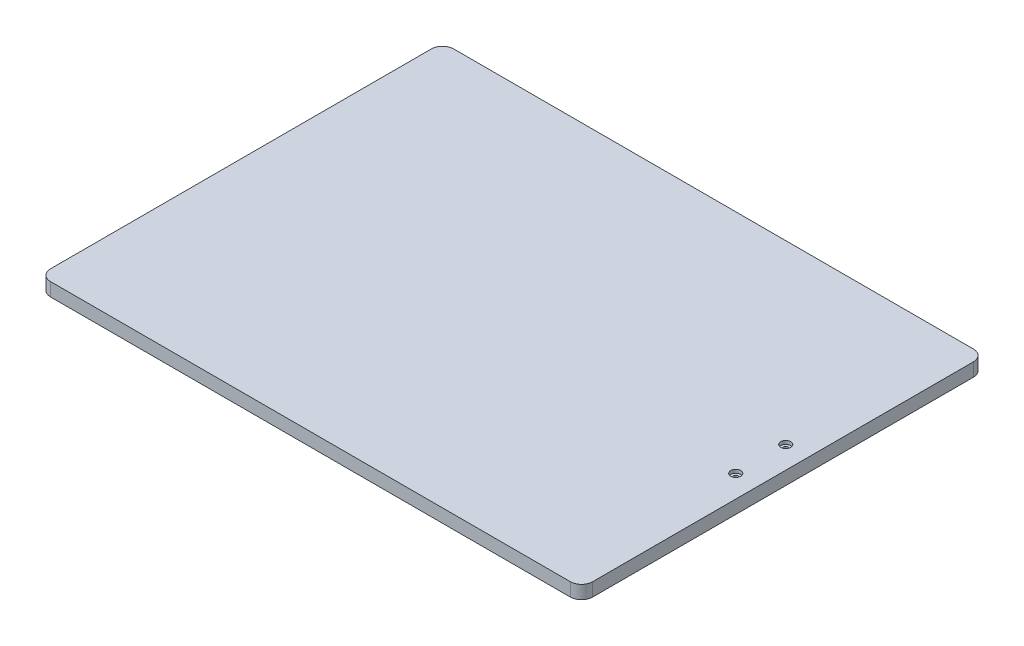
from build123d import *

# Parameters (mm, degrees)
SKETCH1_W                                        = 487.5
SKETCH1_H                                        = 362.5
BOSS_EXTRUDE1_DEPTH                              = 12
FILLET1_R                                        = 10
CBORE_FOR_M4_PAN_HEAD_MACHINE_SCREW1_D           = 4.5
CBORE_FOR_M4_PAN_HEAD_MACHINE_SCREW1_CBORE_D     = 9
CBORE_FOR_M4_PAN_HEAD_MACHINE_SCREW1_CBORE_DEPTH = 3.1


with BuildPart() as part:
    # Sketch1 → Boss-Extrude1 (new body)
    with BuildSketch(Plane(origin=(0, 0, 0), x_dir=(1, 0, 0), z_dir=(0, 1, 0))):
        Rectangle(SKETCH1_W, SKETCH1_H)
    extrude(amount=BOSS_EXTRUDE1_DEPTH)

    # Fillet1
    fillet1_edges = [part.edges().sort_by_distance(p)[0] for p in [
        (243.75, 6, 181.25),
        (-243.75, 6, 181.25),
        (-243.75, 6, -181.25),
        (243.75, 6, -181.25),
    ]]
    fillet(fillet1_edges, radius=FILLET1_R)

    # CBORE for M4 Pan Head Machine Screw1 (through all)
    with Locations(Plane(origin=(0, 12, 0), x_dir=(1, 0, 0), z_dir=(0, 1, 0))):
        with Locations((223.75, -22.5), (223.75, 22.5)):
            CounterBoreHole(CBORE_FOR_M4_PAN_HEAD_MACHINE_SCREW1_D / 2, CBORE_FOR_M4_PAN_HEAD_MACHINE_SCREW1_CBORE_D / 2, CBORE_FOR_M4_PAN_HEAD_MACHINE_SCREW1_CBORE_DEPTH)


solid = part.part
